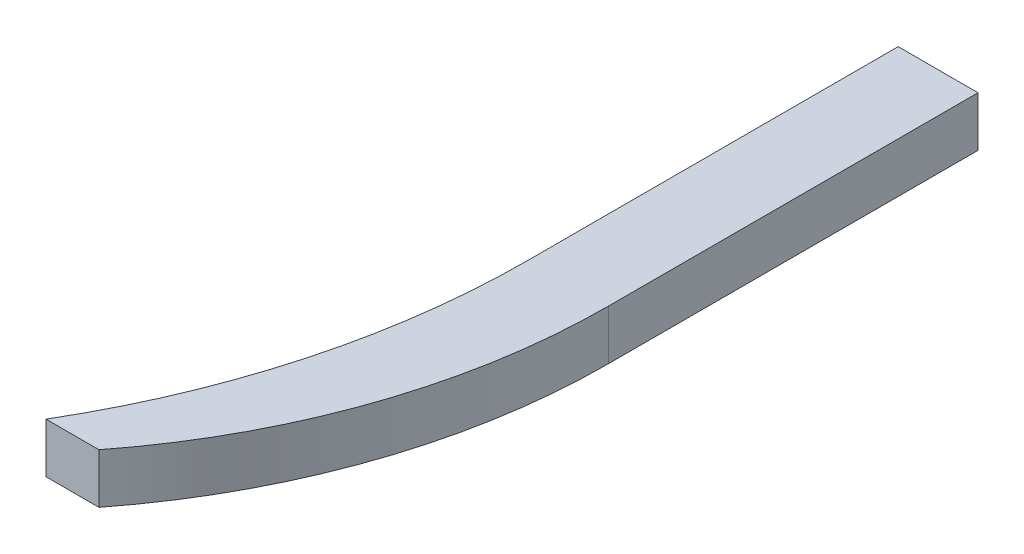
from build123d import *

# Parameters (mm, degrees)
BOSS_EXTRUDE1_DEPTH = 5
CUT_EXTRUDE1_START  = -10
CUT_EXTRUDE1_DEPTH  = 10


with BuildPart() as part:
    # Sketch1 → Boss-Extrude1 (new body)
    with BuildSketch(Plane(origin=(0, 0, 0), x_dir=(1, 0, 0), z_dir=(0, 1, 0))):
        with BuildLine():
            Line((0, 0), (8, 0))
            Line((8, 0), (8, -37))
            ThreePointArc((8, -37), (-0.020288742, -67.450779957), (-22, -90))
            ThreePointArc((-22, -90), (-5.718469366, -65.692333471), (0, -37))
            Line((0, -37), (0, -8))
            Line((0, -8), (0, 0))
        make_face()
    extrude(amount=BOSS_EXTRUDE1_DEPTH)

    # Sketch2 → Cut-Extrude1 (cut)
    with BuildSketch(Plane(origin=(0, 5, 0), x_dir=(1, 0, 0), z_dir=(0, 1, 0)).offset(CUT_EXTRUDE1_START)):
        with BuildLine():
            Line((-10.364854051, -75), (-5.059100302, -75))
            ThreePointArc((-5.059100302, -75), (-12.837382179, -83.28172988), (-22, -90))
            ThreePointArc((-22, -90), (-15.704900448, -82.870406095), (-10.364854051, -75))
        make_face()
    extrude(amount=CUT_EXTRUDE1_DEPTH, mode=Mode.SUBTRACT)


solid = part.part
